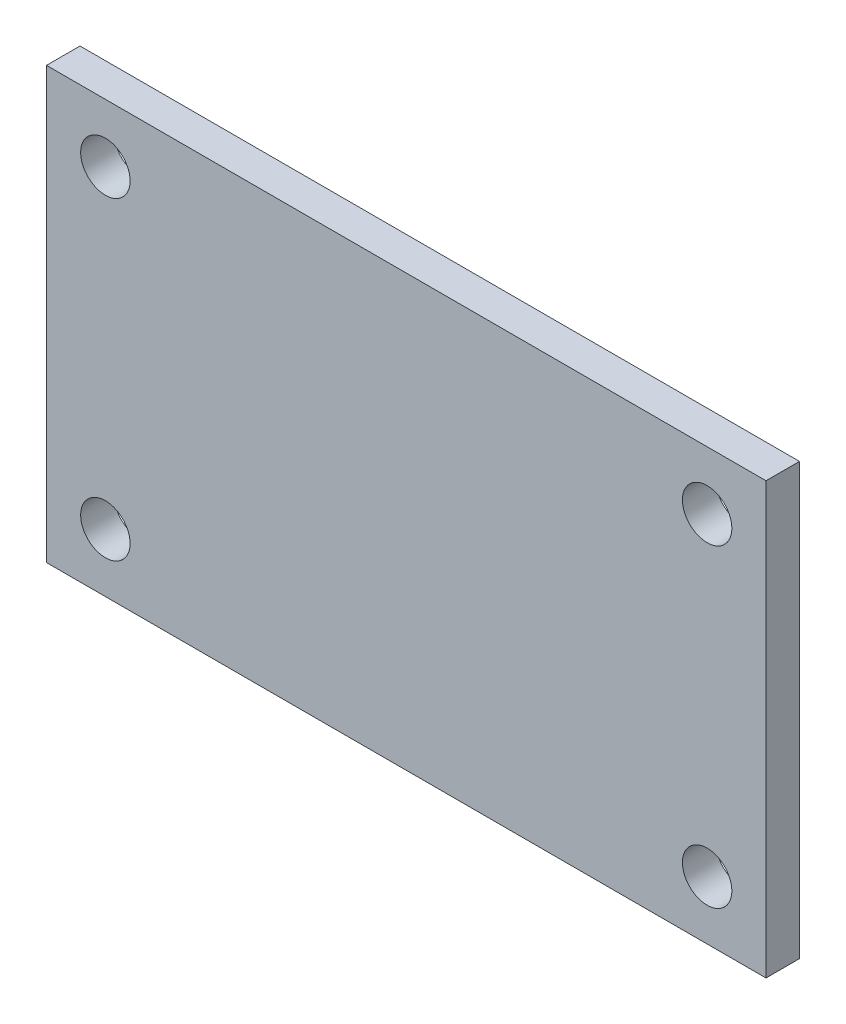
from build123d import *

# Parameters (mm, degrees)
SKETCH1_W            = 34.925
SKETCH1_H            = 20.9042
BOSS_EXTRUDE1_DEPTH  = 0.8128
M2_CLEARANCE_HOLE1_D = 2.4


with BuildPart() as part:
    # Sketch1 → Boss-Extrude1 (new, symmetric)
    with BuildSketch(Plane.XY):
        Rectangle(SKETCH1_W, SKETCH1_H)
    extrude(amount=BOSS_EXTRUDE1_DEPTH, both=True)

    # M2 Clearance Hole1 (through all)
    with Locations(Plane.XY.offset(0.8128)):
        with Locations((-14.605, 7.62), (14.605, 7.62), (14.605, -7.62), (-14.605, -7.62)):
            Hole(M2_CLEARANCE_HOLE1_D / 2)


solid = part.part
